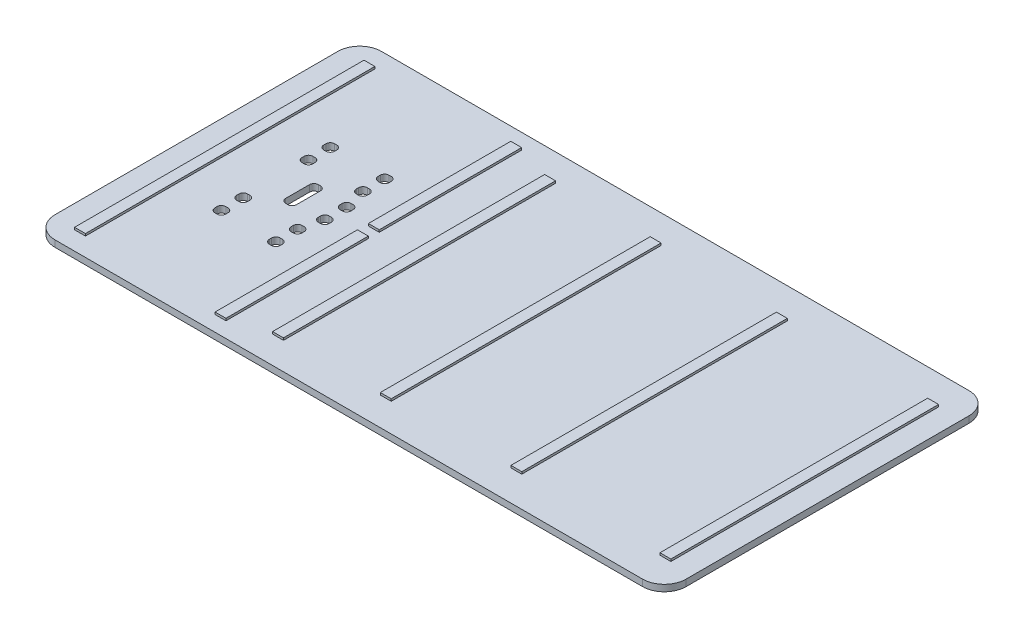
from build123d import *

# Parameters (mm, degrees)
SKETCH2_W                = 5
SKETCH2_H                = 133
ELEMENTGEOMETRY_DEPTH    = 1
SKETCH2_H_2              = 65.435
ELEMENTGEOMETRY_2_DEPTH  = 1
ELEMENTGEOMETRY_3_DEPTH  = 1
SKETCH2_H_3              = 125
ELEMENTGEOMETRY_4_DEPTH  = 1
SKETCH2_H_4              = 124
ELEMENTGEOMETRY_5_DEPTH  = 1
SKETCH2_H_5              = 123
ELEMENTGEOMETRY_6_DEPTH  = 1
SKETCH2_H_6              = 122
ELEMENTGEOMETRY_7_DEPTH  = 1
SKETCH5_W                = 290
SKETCH5_H                = 150
BOARDGEOMETRY_DEPTH      = 3
CABLECUTOUT_REACH        = 165.276
SKETCH7_W                = 5
SKETCH7_H                = 5
SKETCH7_H_2              = 15
MOUNTINGHOLES_DEPTH      = 164.275840221
MOUNTINGHOLES_DEPTH_BACK = 164.275840221
SKETCH8_W                = 5
SKETCH8_H                = 5
BOARDFILLET_R            = 10
MOUNTINGHOLEFILLET_R     = 2


with BuildPart() as part:
    # Sketch2 → ElementGeometry (new body)
    with BuildSketch(Plane(origin=(0, 0, 0), x_dir=(1, 0, 0), z_dir=(0, 1, 0))):
        with Locations((-132, 0)):
            Rectangle(SKETCH2_W, SKETCH2_H)
    extrude(amount=ELEMENTGEOMETRY_DEPTH)



with BuildPart() as body_2:
    # Sketch2 → ElementGeometry 2 (new body)
    with BuildSketch(Plane(origin=(0, 0, 0), x_dir=(1, 0, 0), z_dir=(0, 1, 0))):
        with Locations((-66, 35.2175)):
            Rectangle(SKETCH2_W, SKETCH2_H_2)
    extrude(amount=ELEMENTGEOMETRY_2_DEPTH)


with BuildPart() as body_3:
    # Sketch2 → ElementGeometry 3 (new body)
    with BuildSketch(Plane(origin=(0, 0, 0), x_dir=(1, 0, 0), z_dir=(0, 1, 0))):
        with Locations((-66, -35.2175)):
            Rectangle(SKETCH2_W, SKETCH2_H_2)
    extrude(amount=ELEMENTGEOMETRY_3_DEPTH)


with BuildPart() as body_4:
    # Sketch2 → ElementGeometry 4 (new body)
    with BuildSketch(Plane(origin=(0, 0, 0), x_dir=(1, 0, 0), z_dir=(0, 1, 0))):
        with Locations((-45, 0)):
            Rectangle(SKETCH2_W, SKETCH2_H_3)
    extrude(amount=ELEMENTGEOMETRY_4_DEPTH)


with BuildPart() as body_5:
    # Sketch2 → ElementGeometry 5 (new body)
    with BuildSketch(Plane(origin=(0, 0, 0), x_dir=(1, 0, 0), z_dir=(0, 1, 0))):
        with Locations((4, 0)):
            Rectangle(SKETCH2_W, SKETCH2_H_4)
    extrude(amount=ELEMENTGEOMETRY_5_DEPTH)


with BuildPart() as body_6:
    # Sketch2 → ElementGeometry 6 (new body)
    with BuildSketch(Plane(origin=(0, 0, 0), x_dir=(1, 0, 0), z_dir=(0, 1, 0))):
        with Locations((132, 0)):
            Rectangle(SKETCH2_W, SKETCH2_H_5)
    extrude(amount=ELEMENTGEOMETRY_6_DEPTH)


with BuildPart() as body_7:
    # Sketch2 → ElementGeometry 7 (new body)
    with BuildSketch(Plane(origin=(0, 0, 0), x_dir=(1, 0, 0), z_dir=(0, 1, 0))):
        with Locations((63, 0)):
            Rectangle(SKETCH2_W, SKETCH2_H_6)
    extrude(amount=ELEMENTGEOMETRY_7_DEPTH)


with BuildPart() as part_1:
    add(part.part)

    add(body_2.part)  # BoardGeometry merges body 2

    add(body_3.part)  # BoardGeometry merges body 3

    add(body_4.part)  # BoardGeometry merges body 4

    add(body_5.part)  # BoardGeometry merges body 5

    add(body_6.part)  # BoardGeometry merges body 6

    add(body_7.part)  # BoardGeometry merges body 7
    # Sketch5 → BoardGeometry (add)
    with BuildSketch(Plane(origin=(0, 0, 0), x_dir=(1, 0, 0), z_dir=(0, 1, 0))):
        Rectangle(SKETCH5_W, SKETCH5_H)
    extrude(amount=-BOARDGEOMETRY_DEPTH)

    # Sketch7 → CableCutout (cut, up to next)
    with BuildSketch(Plane(origin=(0, 0, 0), x_dir=(1, 0, 0), z_dir=(0, 1, 0)), mode=Mode.PRIVATE) as cablecutout_sk1:
        with Locations((-81, -5)):
            Rectangle(SKETCH7_W, SKETCH7_H)
    cablecutout_tool1 = extrude(cablecutout_sk1.sketch, amount=-CABLECUTOUT_REACH, mode=Mode.PRIVATE) & part_1.part
    # Sketch7 → CableCutout (cut, up to next)
    with BuildSketch(Plane(origin=(0, 0, 0), x_dir=(1, 0, 0), z_dir=(0, 1, 0)), mode=Mode.PRIVATE) as cablecutout_sk2:
        with Locations((-81, 5)):
            Rectangle(SKETCH7_W, SKETCH7_H)
    cablecutout_tool2 = extrude(cablecutout_sk2.sketch, amount=-CABLECUTOUT_REACH, mode=Mode.PRIVATE) & part_1.part
    # Sketch7 → CableCutout (cut, up to next)
    with BuildSketch(Plane(origin=(0, 0, 0), x_dir=(1, 0, 0), z_dir=(0, 1, 0)), mode=Mode.PRIVATE) as cablecutout_sk3:
        with Locations((-96, 0)):
            Rectangle(SKETCH7_W, SKETCH7_H_2)
    cablecutout_tool3 = extrude(cablecutout_sk3.sketch, amount=-CABLECUTOUT_REACH, mode=Mode.PRIVATE) & part_1.part
    add(cablecutout_tool1.solids().sort_by_distance((-81, 0, 5))[0], mode=Mode.SUBTRACT)
    add(cablecutout_tool2.solids().sort_by_distance((-81, 0, -5))[0], mode=Mode.SUBTRACT)
    add(cablecutout_tool3.solids().sort_by_distance((-96, 0, 0))[0], mode=Mode.SUBTRACT)

    # Sketch8 → MountingHoles (cut, two sides: drawn at the far end of the back side and taken through both)
    with BuildSketch(Plane(origin=(0, 0, 0), x_dir=(1, 0, 0), z_dir=(0, 1, 0)).offset(-MOUNTINGHOLES_DEPTH_BACK)):
        with Locations((-108.5, 15)):
            Rectangle(SKETCH8_W, SKETCH8_H)
        with Locations((-83.5, 15)):
            Rectangle(SKETCH8_W, SKETCH8_H)
        with Locations((-83.5, -15)):
            Rectangle(SKETCH8_W, SKETCH8_H)
        with Locations((-108.5, -15)):
            Rectangle(SKETCH8_W, SKETCH8_H)
        with Locations((-83.5, -25)):
            Rectangle(SKETCH8_W, SKETCH8_H)
        with Locations((-108.5, -25)):
            Rectangle(SKETCH8_W, SKETCH8_H)
        with Locations((-83.5, 25)):
            Rectangle(SKETCH8_W, SKETCH8_H)
        with Locations((-108.5, 25)):
            Rectangle(SKETCH8_W, SKETCH8_H)
    extrude(amount=MOUNTINGHOLES_DEPTH + MOUNTINGHOLES_DEPTH_BACK, mode=Mode.SUBTRACT)

    # BoardFillet
    boardfillet_edges = [part_1.edges().sort_by_distance(p)[0] for p in [
        (-145, -1.5, -75),
        (145, -1.5, -75),
        (145, -1.5, 75),
        (-145, -1.5, 75),
    ]]
    fillet(boardfillet_edges, radius=BOARDFILLET_R)

    # MountingHoleFillet
    mountingholefillet_edges = [part_1.edges().sort_by_distance(p)[0] for p in [
        (-78.5, -1.5, -2.5),
        (-83.5, -1.5, -2.5),
        (-83.5, -1.5, -7.5),
        (-78.5, -1.5, -7.5),
        (-78.5, -1.5, 2.5),
        (-78.5, -1.5, 7.5),
        (-83.5, -1.5, 7.5),
        (-83.5, -1.5, 2.5),
        (-111, -1.5, 12.5),
        (-106, -1.5, 12.5),
        (-106, -1.5, 17.5),
        (-111, -1.5, 17.5),
        (-86, -1.5, 12.5),
        (-81, -1.5, 12.5),
        (-81, -1.5, 17.5),
        (-86, -1.5, 17.5),
        (-106, -1.5, 22.5),
        (-106, -1.5, 27.5),
        (-111, -1.5, 27.5),
        (-111, -1.5, 22.5),
        (-86, -1.5, -17.5),
        (-81, -1.5, -17.5),
        (-81, -1.5, -12.5),
        (-86, -1.5, -12.5),
        (-81, -1.5, 22.5),
        (-81, -1.5, 27.5),
        (-86, -1.5, 27.5),
        (-86, -1.5, 22.5),
        (-81, -1.5, -27.5),
        (-81, -1.5, -22.5),
        (-86, -1.5, -22.5),
        (-86, -1.5, -27.5),
        (-106, -1.5, -22.5),
        (-111, -1.5, -22.5),
        (-111, -1.5, -27.5),
        (-106, -1.5, -27.5),
        (-106, -1.5, -17.5),
        (-106, -1.5, -12.5),
        (-111, -1.5, -12.5),
        (-111, -1.5, -17.5),
        (-93.5, -1.5, -7.5),
        (-93.5, -1.5, 7.5),
        (-98.5, -1.5, 7.5),
        (-98.5, -1.5, -7.5),
    ]]
    fillet(mountingholefillet_edges, radius=MOUNTINGHOLEFILLET_R)


solid = part_1.part
